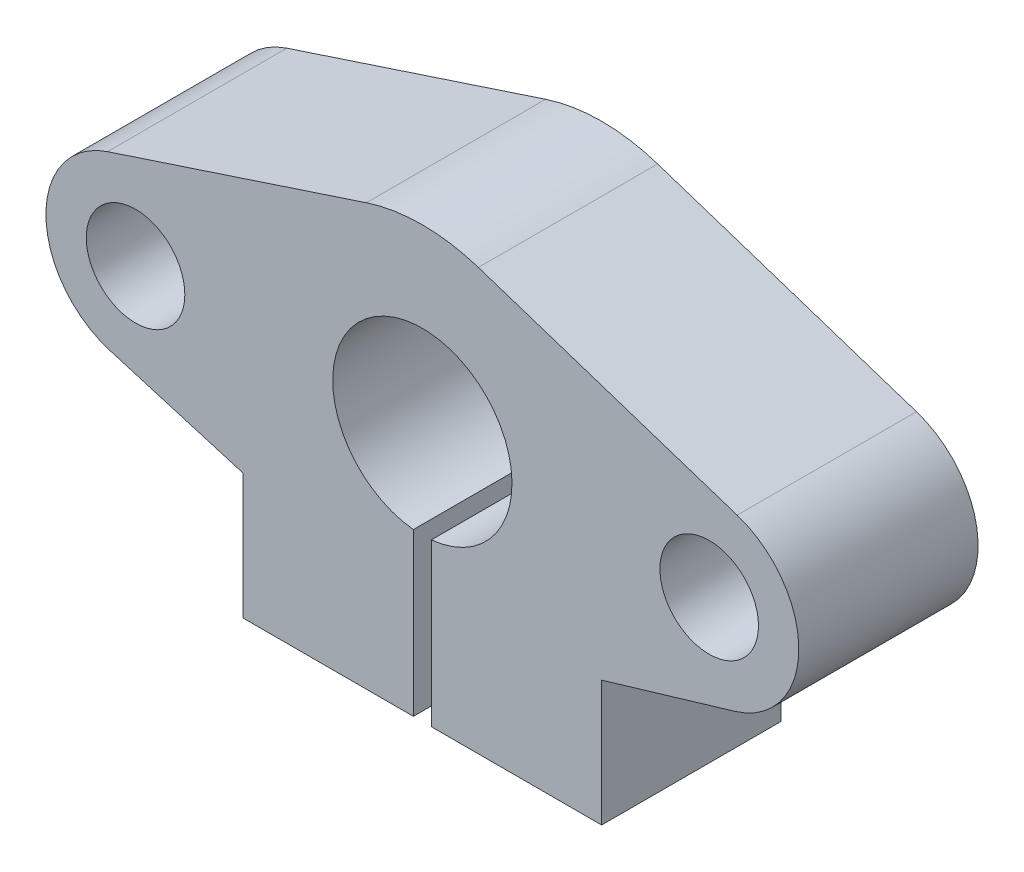
from build123d import *

# Parameters (mm, degrees)
SKETCH_1_R      = 5
SKETCH_1_R_2    = 2.75
EXTRUDE_1_DEPTH = 10


with BuildPart() as part:
    # 草图1 → 凸台-拉伸1 (new body)
    # profile 1 of 5: a face of its own
    with BuildSketch(Plane.XY):
        with BuildLine():
            ThreePointArc((3.125, 9.499177596), (0, 10), (-3.125, 9.499177596))
            ThreePointArc((-3.125, 9.499177596), (-9.91048591, -1.335016492), (-0.5, -9.987492178))
            Line((-0.5, -9.987492178), (-0.5, -7.481214682))
            Line((-0.5, -7.481214682), (-0.5, -4.974937186))
            ThreePointArc((-0.5, -4.974937186), (-3.354101966, 3.708099244), (5, 0))
            ThreePointArc((5, 0), (3.708099244, -3.354101966), (0.5, -4.974937186))
            Line((0.5, -4.974937186), (0.5, -7.481214682))
            Line((0.5, -7.481214682), (0.5, -9.987492178))
            ThreePointArc((0.5, -9.987492178), (7.245688373, -6.892024376), (10, 0))
            ThreePointArc((10, 0), (8.100925873, 5.8630197), (3.125, 9.499177596))
        make_face()
    # profile 2 of 5: a face of its own
    with BuildSketch(Plane.XY):
        with BuildLine():
            Line((-3.125, 9.499177596), (-17.5625, 4.749588798))
            ThreePointArc((-17.5625, 4.749588798), (-13.06849015, 4.050462937), (-11, 0))
            ThreePointArc((-11, 0), (-13.010355295, -4.007745568), (-17.424809815, -4.792694127))
            Line((-17.424809815, -4.792694127), (-10, -7))
            Line((-10, -7), (-10, -14))
            Line((-10, -14), (-0.5, -14))
            Line((-0.5, -14), (-0.5, -9.987492178))
            ThreePointArc((-0.5, -9.987492178), (-9.91048591, -1.335016492), (-3.125, 9.499177596))
        make_face()
    # profile 3 of 5: a face of its own
    with BuildSketch(Plane.XY):
        with Locations((-16, 0)):
            Circle(SKETCH_1_R)
        with Locations((-16, 0)):
            Circle(SKETCH_1_R_2, mode=Mode.SUBTRACT)
    # profile 4 of 5: a face of its own
    with BuildSketch(Plane.XY):
        with BuildLine():
            Line((17.5625, 4.749588798), (3.125, 9.499177596))
            ThreePointArc((3.125, 9.499177596), (8.100925873, 5.8630197), (10, 0))
            ThreePointArc((10, 0), (7.245688373, -6.892024376), (0.5, -9.987492178))
            Line((0.5, -9.987492178), (0.5, -14))
            Line((0.5, -14), (10, -14))
            Line((10, -14), (10, -7))
            Line((10, -7), (17.424809815, -4.792694127))
            ThreePointArc((17.424809815, -4.792694127), (11.000520443, 0.072139893), (17.5625, 4.749588798))
        make_face()
    # profile 5 of 5: a face of its own
    with BuildSketch(Plane.XY):
        with Locations((16, 0)):
            Circle(SKETCH_1_R)
        with Locations((16, 0)):
            Circle(SKETCH_1_R_2, mode=Mode.SUBTRACT)
    extrude(amount=EXTRUDE_1_DEPTH)


solid = part.part
